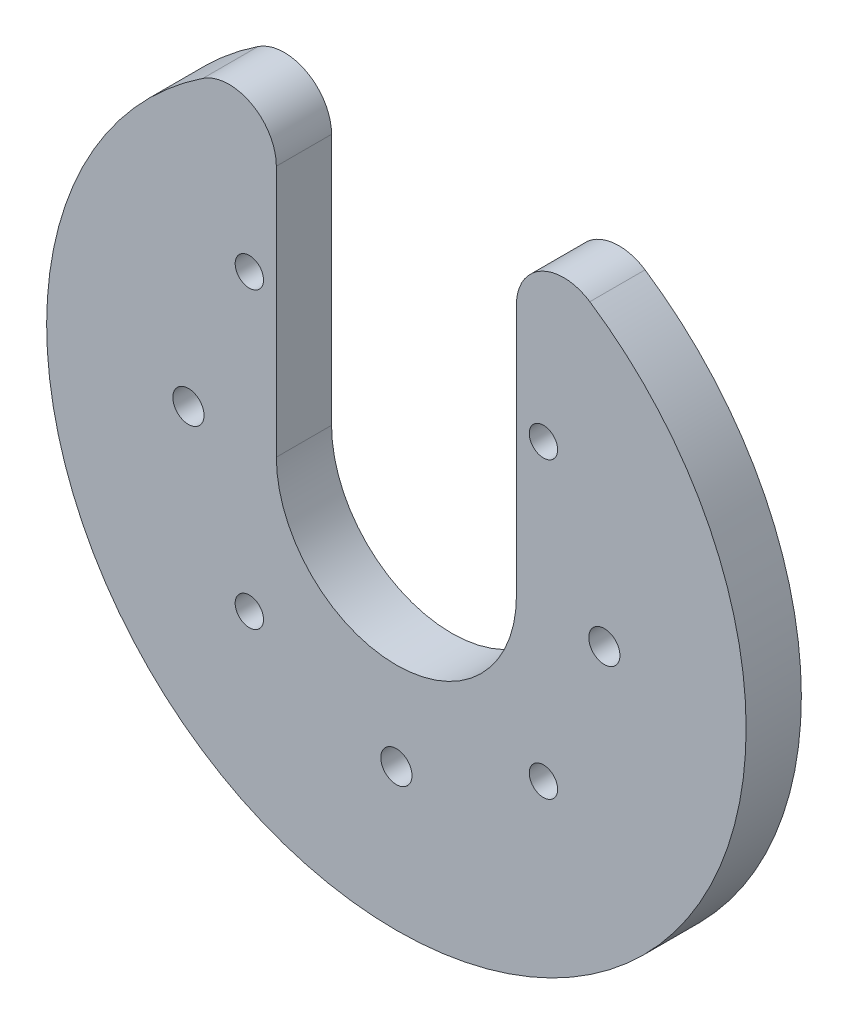
from build123d import *

# Parameters (mm, degrees)
SKETCH1_R           = 1.65
BOSS_EXTRUDE1_DEPTH = 5.842
FILLET1_R           = 5
SKETCH2_R           = 1.5
CUT_EXTRUDE1_DEPTH  = 53.651011044


with BuildPart() as part:
    # Sketch1 → Boss-Extrude1 (new body)
    with BuildSketch(Plane.XY):
        with BuildLine():
            Line((-12.7, 0), (-12.7, 34.752122237))
            ThreePointArc((-12.7, 34.752122237), (0, -37), (12.7, 34.752122237))
            Line((12.7, 34.752122237), (12.7, 0))
            ThreePointArc((12.7, 0), (0, -12.7), (-12.7, 0))
        make_face()
        with Locations((22, 0)):
            Circle(SKETCH1_R, mode=Mode.SUBTRACT)
        with Locations((0, -22)):
            Circle(SKETCH1_R, mode=Mode.SUBTRACT)
        with Locations((-22, 0)):
            Circle(SKETCH1_R, mode=Mode.SUBTRACT)
    extrude(amount=BOSS_EXTRUDE1_DEPTH)

    # Fillet1
    fillet1_edges = [part.edges().sort_by_distance(p)[0] for p in [
        (12.7, 34.752122237, 2.921),
        (-12.7, 34.752122237, 2.921),
    ]]
    fillet(fillet1_edges, radius=FILLET1_R)

    # Sketch2 → Cut-Extrude1 (cut, through all)
    with BuildSketch(Plane.XY.offset(5.842)):
        with Locations((-15.556349186, -15.556349186)):
            Circle(SKETCH2_R)
        with Locations((-15.556349186, 15.556349186)):
            Circle(SKETCH2_R)
        with Locations((15.556349186, 15.556349186)):
            Circle(SKETCH2_R)
        with Locations((15.556349186, -15.556349186)):
            Circle(SKETCH2_R)
    extrude(amount=-CUT_EXTRUDE1_DEPTH, mode=Mode.SUBTRACT)


solid = part.part
